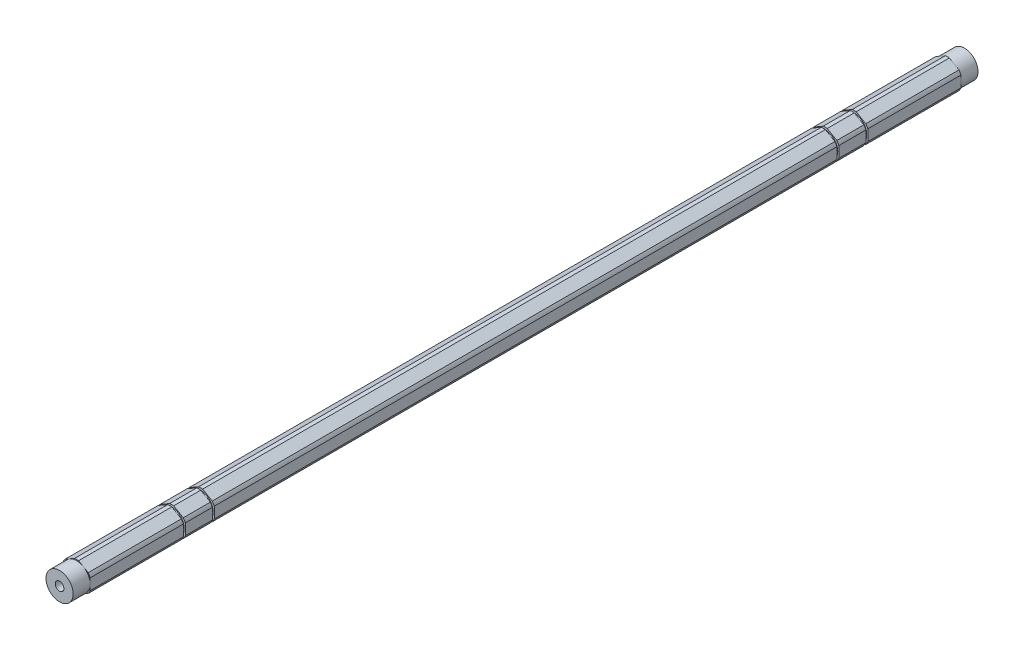
from build123d import *

# Parameters (mm, degrees)
BOSS_EXTRUDE1_DEPTH                  = 203.2
SKETCH6_R                            = 6.35
BOSS_EXTRUDE2_DEPTH                  = 7.9375
F_10_32_TAPPED_HOLE1_D               = 4.0386
F_10_32_TAPPED_HOLE1_DEPTH           = 16.34744
F_10_32_TAPPED_HOLE1_TIP             = 1.213317848
F_10_32_TAPPED_HOLE1_ON_FACE_2_D     = 4.0386
F_10_32_TAPPED_HOLE1_ON_FACE_2_DEPTH = 16.34744
F_10_32_TAPPED_HOLE1_ON_FACE_2_TIP   = 1.213317848
SKETCH5_W                            = 0.889
SKETCH5_H                            = 1.0033


with BuildPart() as part:
    # Sketch1 → Boss-Extrude1 (new, symmetric)
    with BuildSketch(Plane.XY):
        with BuildLine():
            ThreePointArc((0.93173274, 6.79441227), (0, 6.858), (-0.93173274, 6.79441227))
            Line((-0.93173274, 6.79441227), (-5.41826726, 4.204110358))
            ThreePointArc((-5.41826726, 4.204110358), (-5.939202219, 3.429), (-6.35, 2.590301913))
            Line((-6.35, 2.590301913), (-6.35, -2.590301913))
            ThreePointArc((-6.35, -2.590301913), (-5.939202219, -3.429), (-5.41826726, -4.204110358))
            Line((-5.41826726, -4.204110358), (-0.93173274, -6.79441227))
            ThreePointArc((-0.93173274, -6.79441227), (0, -6.858), (0.93173274, -6.79441227))
            Line((0.93173274, -6.79441227), (5.41826726, -4.204110358))
            ThreePointArc((5.41826726, -4.204110358), (5.939202219, -3.429), (6.35, -2.590301913))
            Line((6.35, -2.590301913), (6.35, 2.590301913))
            ThreePointArc((6.35, 2.590301913), (5.939202219, 3.429), (5.41826726, 4.204110358))
            Line((5.41826726, 4.204110358), (0.93173274, 6.79441227))
        make_face()
    extrude(amount=BOSS_EXTRUDE1_DEPTH, both=True)

    # Sketch6 → Boss-Extrude2 (add)
    with BuildSketch(Plane.XY.offset(203.2)):
        Circle(SKETCH6_R)
    boss_extrude2 = extrude(amount=BOSS_EXTRUDE2_DEPTH)

    # Mirror2: Boss-Extrude2 across plane
    add(boss_extrude2.mirror(Plane.XY))

    # #10-32 Tapped Hole1
    with Locations(Plane.XY.offset(211.1375)):
        with Locations((0, 0)):
            Hole(F_10_32_TAPPED_HOLE1_D / 2, depth=F_10_32_TAPPED_HOLE1_DEPTH)
            with Locations((0, 0, -(F_10_32_TAPPED_HOLE1_DEPTH + F_10_32_TAPPED_HOLE1_TIP / 2))):  # 118° drill point
                Cone(0, F_10_32_TAPPED_HOLE1_D / 2, F_10_32_TAPPED_HOLE1_TIP, mode=Mode.SUBTRACT)

    # #10-32 Tapped Hole1 on face 2
    with Locations(Plane(origin=(0, 0, -211.1375), x_dir=(-1, 0, 0), z_dir=(0, 0, -1))):
        with Locations((0, 0)):
            Hole(F_10_32_TAPPED_HOLE1_ON_FACE_2_D / 2, depth=F_10_32_TAPPED_HOLE1_ON_FACE_2_DEPTH)
            with Locations((0, 0, -(F_10_32_TAPPED_HOLE1_ON_FACE_2_DEPTH + F_10_32_TAPPED_HOLE1_ON_FACE_2_TIP / 2))):  # 118° drill point
                Cone(0, F_10_32_TAPPED_HOLE1_ON_FACE_2_D / 2, F_10_32_TAPPED_HOLE1_ON_FACE_2_TIP, mode=Mode.SUBTRACT)

    # Sketch5 → Cut-Revolve1 (revolve, cut)
    with BuildSketch(Plane(origin=(0, 0, 0), x_dir=(0, 0, -1), z_dir=(1, 0, 0)), mode=Mode.PRIVATE) as cut_revolve1_sk:
        with Locations((-159.26308, 6.35635)):
            Rectangle(SKETCH5_W, SKETCH5_H)
        with Locations((-145.73758, 6.35635)):
            Rectangle(SKETCH5_W, SKETCH5_H)
    cut_revolve1 = revolve(cut_revolve1_sk.sketch.rotate(Axis((0, 0, 165.047176272), (0, 0, -1)), 90), axis=Axis((0, 0, 165.047176272), (0, 0, -1)), mode=Mode.SUBTRACT)

    # Mirror1: Cut-Revolve1 across plane
    add(cut_revolve1.mirror(Plane.XY), mode=Mode.SUBTRACT)


solid = part.part
